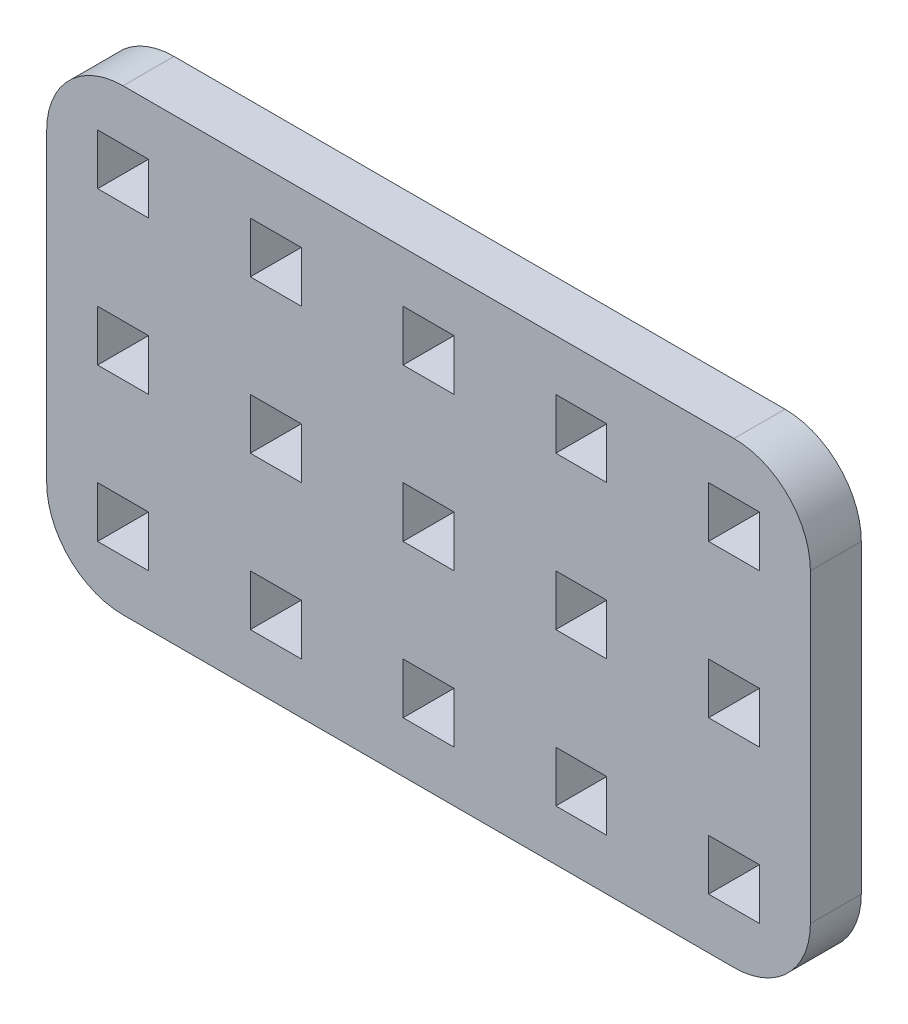
from build123d import *

# Parameters (mm, degrees)
MODEL_W                 = 3
MODEL_H                 = 3
SALIENTE_EXTRUIR1_DEPTH = 3


with BuildPart() as part:
    # Model → Saliente-Extruir1 (new body)
    with BuildSketch(Plane.XY):
        with BuildLine():
            Line((12.639309496, 299.028131514), (48.639309496, 299.028131514))
            ThreePointArc((48.639309496, 299.028131514), (51.821290011, 297.71011203), (53.139309496, 294.528131514))
            Line((53.139309496, 294.528131514), (53.139309496, 276.528131514))
            ThreePointArc((53.139309496, 276.528131514), (51.821290011, 273.346150999), (48.639309496, 272.028131514))
            Line((48.639309496, 272.028131514), (12.639309496, 272.028131514))
            ThreePointArc((12.639309496, 272.028131514), (9.457328981, 273.346150999), (8.139309496, 276.528131514))
            Line((8.139309496, 276.528131514), (8.139309496, 294.528131514))
            ThreePointArc((8.139309496, 294.528131514), (9.457328981, 297.71011203), (12.639309496, 299.028131514))
        make_face()
        with Locations((12.639309496, 294.528131514)):
            Rectangle(MODEL_W, MODEL_H, mode=Mode.SUBTRACT)
        with Locations((21.639309496, 294.528131514)):
            Rectangle(MODEL_W, MODEL_H, mode=Mode.SUBTRACT)
        with Locations((30.639309496, 294.528131514)):
            Rectangle(MODEL_W, MODEL_H, mode=Mode.SUBTRACT)
        with Locations((39.639309496, 294.528131514)):
            Rectangle(MODEL_W, MODEL_H, mode=Mode.SUBTRACT)
        with Locations((48.639309496, 294.528131514)):
            Rectangle(MODEL_W, MODEL_H, mode=Mode.SUBTRACT)
        with Locations((12.639309496, 276.528131514)):
            Rectangle(MODEL_W, MODEL_H, mode=Mode.SUBTRACT)
        with Locations((21.639309496, 276.528131514)):
            Rectangle(MODEL_W, MODEL_H, mode=Mode.SUBTRACT)
        with Locations((30.639309496, 276.528131514)):
            Rectangle(MODEL_W, MODEL_H, mode=Mode.SUBTRACT)
        with Locations((39.639309496, 276.528131514)):
            Rectangle(MODEL_W, MODEL_H, mode=Mode.SUBTRACT)
        with Locations((48.639309496, 276.528131514)):
            Rectangle(MODEL_W, MODEL_H, mode=Mode.SUBTRACT)
        with Locations((12.639309496, 285.528131514)):
            Rectangle(MODEL_W, MODEL_H, mode=Mode.SUBTRACT)
        with Locations((21.639309496, 285.528131514)):
            Rectangle(MODEL_W, MODEL_H, mode=Mode.SUBTRACT)
        with Locations((30.639309496, 285.528131514)):
            Rectangle(MODEL_W, MODEL_H, mode=Mode.SUBTRACT)
        with Locations((39.639309496, 285.528131514)):
            Rectangle(MODEL_W, MODEL_H, mode=Mode.SUBTRACT)
        with Locations((48.639309496, 285.528131514)):
            Rectangle(MODEL_W, MODEL_H, mode=Mode.SUBTRACT)
    extrude(amount=SALIENTE_EXTRUIR1_DEPTH)


solid = part.part
